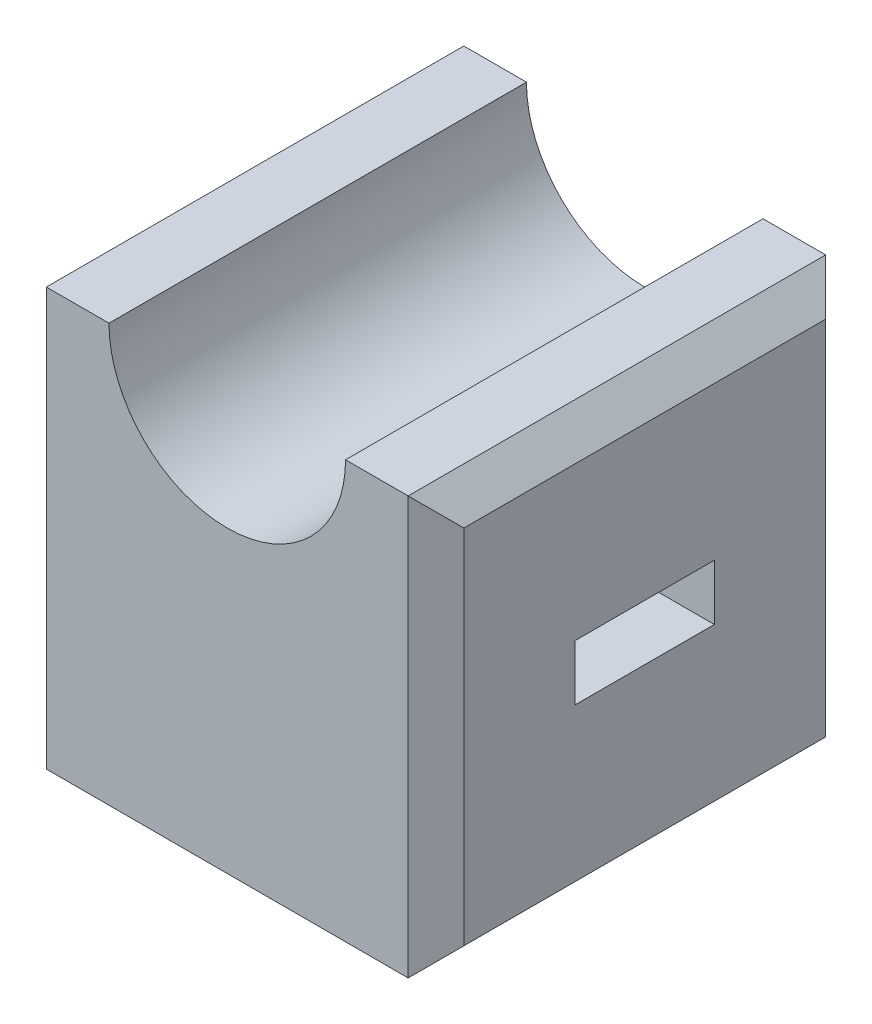
from build123d import *

# Parameters (mm, degrees)
EXTRUDE_1_DEPTH     = 30
SKETCH_2_W          = 10
SKETCH_2_H          = 4
CUT_EXTRUDE_1_DEPTH = 46
CHAMFER_1_SIZE      = 2
CHAMFER_2_SIZE      = 2
CHAMFER_3_SIZE      = 2


with BuildPart() as part:
    # 草图1 → 凸台-拉伸1 (new body)
    with BuildSketch(Plane.XY):
        with BuildLine():
            Line((8.5, 15), (15, 15))
            Line((15, 15), (15, -15))
            Line((15, -15), (-15, -15))
            Line((-15, -15), (-15, 15))
            Line((-15, 15), (-8.5, 15))
            ThreePointArc((-8.5, 15), (0, 6.5), (8.5, 15))
        make_face()
    extrude(amount=EXTRUDE_1_DEPTH)

    # 草图2 → 切除-拉伸1 (cut, through all)
    with BuildSketch(Plane(origin=(15, 0, 0), x_dir=(0, 0, -1), z_dir=(1, 0, 0))):
        with Locations((-15, 0)):
            Rectangle(SKETCH_2_W, SKETCH_2_H)
    extrude(amount=-CUT_EXTRUDE_1_DEPTH, mode=Mode.SUBTRACT)

    # 倒角1
    chamfer_1_edges = [part.edges().sort_by_distance(p)[0] for p in [
        (-15, 15, 15),
        (15, 15, 15),
    ]]
    chamfer(chamfer_1_edges, length=CHAMFER_1_SIZE)

    # 倒角2
    chamfer_2_edges = [part.edges().sort_by_distance(p)[0] for p in [
        (15, -15, 15),
        (-15, -15, 15),
    ]]
    chamfer(chamfer_2_edges, length=CHAMFER_2_SIZE)

    # 倒角3
    chamfer_3_edges = [part.edges().sort_by_distance(p)[0] for p in [
        (-15, 0, 0),
        (-15, 0, 30),
        (15, 0, 30),
        (15, 0, 0),
    ]]
    chamfer(chamfer_3_edges, length=CHAMFER_3_SIZE)


solid = part.part
